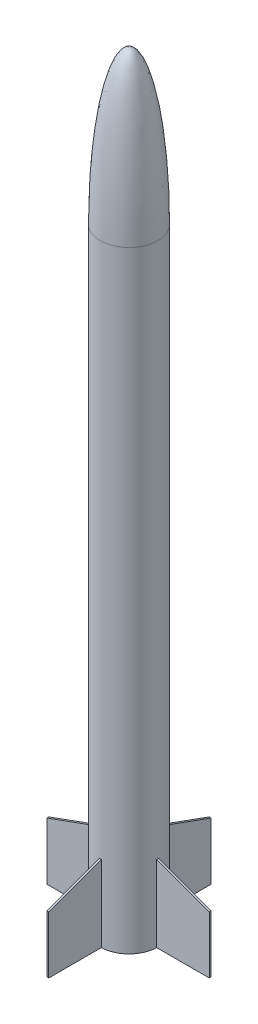
from build123d import *

# Parameters (mm, degrees)
SKETCH2_W         = 59.5
SKETCH2_H         = 300
FIN_DEPTH         = 2.5
FIN_DEPTH_BACK    = 2.5
CIRPATTERN1_COUNT = 4


with BuildPart() as part:
    # Sketch1 → Body & Nose cone (revolve)
    with BuildSketch(Plane.XY):
        with BuildLine():
            Line((75, 0), (75, 1600))
            add(Edge.make_bspline(
                [(75, 1600), (75, 2000), (0, 2000)],
                knots=[4.71238898, 4.71238898, 4.71238898, 6.283185307, 6.283185307, 6.283185307], degree=2, weights=[1, 0.707106781, 1]))
            Line((0, 2000), (0, 1990))
            add(Edge.make_bspline(
                [(65, 1600), (65, 1613.007957211), (64.759968131, 1639.095384497), (63.683466983, 1677.787515837), (61.901226536, 1715.735115601), (58.608383984, 1764.819099691), (52.833238626, 1822.438339213), (45.080843897, 1872.790763823), (37.900693419, 1907.488438648), (32.095591571, 1930.442333932), (25.954916584, 1950.058633445), (19.595694201, 1966.073409043), (13.20920876, 1978.215646365), (8.166651652, 1984.847886438), (4.723308806, 1987.995295154), (2.603148331, 1989.352559855), (1.325363723, 1989.82561113), (0.530306282, 1989.97751645), (0.181198322, 1990), (0, 1990)],
                knots=[-1.570796327, -1.570796327, -1.570796327, -1.570796327, -1.472621556, -1.374446786, -1.276272016, -1.178097245, -0.981747704, -0.785398163, -0.687223393, -0.589048623, -0.490873852, -0.392699082, -0.294524311, -0.196349541, -0.147262156, -0.09817477, -0.049087385, -0.024543693, 0, 0, 0, 0], degree=3))
            Line((65, 1600), (65, 0))
            Line((65, 0), (75, 0))
        make_face()
    revolve(axis=Axis((0, 0, 0), (0, 1, 0)))

    # Sketch2 → Tube Coupler (revolve)
    with BuildSketch(Plane.XY):
        with Locations((29.75, 1600)):
            Rectangle(SKETCH2_W, SKETCH2_H)
    revolve(axis=Axis((0, 0, 0), (0, 1, 0)))


with BuildPart() as body_2:
    # Sketch3 → Fin (new, two sides: drawn at the far end of the back side and taken through both)
    with BuildSketch(Plane.XY.offset(-FIN_DEPTH_BACK)):
        Polygon((75, 0), (212.373870973, 0), (212.373870973, 150), (75, 200), (75, 150.9), (70, 150.9), (70, 15.9), (75, 15.9), align=None)
    extrude(amount=FIN_DEPTH + FIN_DEPTH_BACK)


with BuildPart() as cirpattern1_1:
    # CirPattern1: pattern copy
    add(body_2.part.rotate(Axis((0, 0, 0), (0, -1, 0)), 1 * 360 / CIRPATTERN1_COUNT))


with BuildPart() as cirpattern1_2:
    # CirPattern1: pattern copy
    add(body_2.part.rotate(Axis((0, 0, 0), (0, -1, 0)), 2 * 360 / CIRPATTERN1_COUNT))


with BuildPart() as cirpattern1_3:
    # CirPattern1: pattern copy
    add(body_2.part.rotate(Axis((0, 0, 0), (0, -1, 0)), 3 * 360 / CIRPATTERN1_COUNT))


solid = Compound([part.part, body_2.part, cirpattern1_1.part, cirpattern1_2.part, cirpattern1_3.part])
